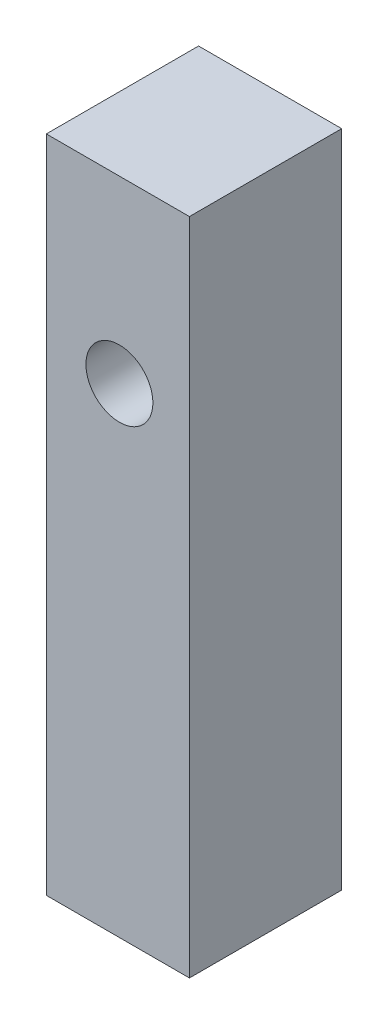
from build123d import *

# Parameters (mm, degrees)
SKETCH_1_R      = 1.1
EXTRUDE_1_DEPTH = 5


with BuildPart() as part:
    # 草图1 → 凸台-拉伸1 (new body)
    with BuildSketch(Plane.XY):
        Polygon((11.25, -15.755), (15.95, -15.755), (15.95, 0.65), (15.95, 5.9), (11.25, 5.9), align=None)
        with Locations((13.65, 0)):
            Circle(SKETCH_1_R, mode=Mode.SUBTRACT)
    extrude(amount=EXTRUDE_1_DEPTH)


solid = part.part
